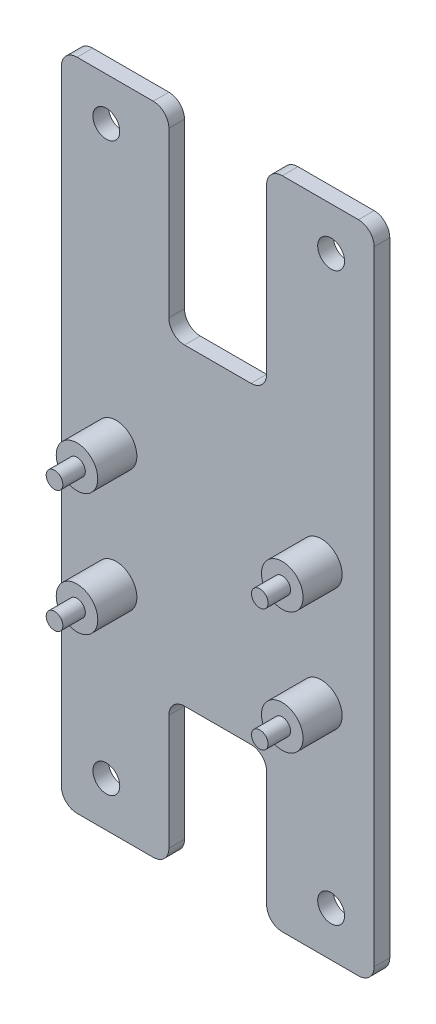
from build123d import *

# Parameters (mm, degrees)
SZKIC2_W                        = 32
SZKIC2_H                        = 67
SZKIC2_R                        = 1.375001118
SZKIC2_R_2                      = 1.375002453
SZKIC2_R_3                      = 1.374998979
SZKIC2_R_4                      = 1.375001969
DODANIE_WYCI_GNI_CIE1_DEPTH     = 1.6
SZKIC3_R                        = 2.125002003
SZKIC3_R_2                      = 2.125000412
SZKIC3_R_3                      = 2.124999361
SZKIC3_R_4                      = 2.125
DODANIE_WYCI_GNI_CIE2_DEPTH     = 4
SZKIC4_R                        = 0.85
DODANIE_WYCI_GNI_CIE3_DEPTH     = 2.3
WYTNIJ_WYCI_GNI_CIE1_DEPTH      = 75.51637404
WYTNIJ_WYCI_GNI_CIE1_DEPTH_BACK = 75.51637404
SZKIC5_W                        = 10
SZKIC5_H                        = 20
SZKIC5_H_2                      = 15
ZAOKR_GLENIE1_R                 = 1.6


with BuildPart() as part:
    # Szkic2 → Dodanie-wyciągnięcie1 (new body)
    with BuildSketch(Plane.XY):
        with Locations((16, 33.5)):
            Rectangle(SZKIC2_W, SZKIC2_H)
        with Locations((4.60000054, 4.59999621)):
            Circle(SZKIC2_R, mode=Mode.SUBTRACT)
        with Locations((27.599994617, 4.599998848)):
            Circle(SZKIC2_R_2, mode=Mode.SUBTRACT)
        with Locations((27.599997676, 62.599998714)):
            Circle(SZKIC2_R_3, mode=Mode.SUBTRACT)
        with Locations((4.599996565, 62.599994963)):
            Circle(SZKIC2_R_4, mode=Mode.SUBTRACT)
    extrude(amount=DODANIE_WYCI_GNI_CIE1_DEPTH)

    # Szkic3 → Dodanie-wyciągnięcie2 (add)
    with BuildSketch(Plane.XY.offset(1.6)):
        with Locations(Location((5.599998705, 34.699994945, 0), (0, 0, 180))):
            Circle(SZKIC3_R)
        with Locations(Location((26.599994052, 34.699996536, 0), (0, 0, 180))):
            Circle(SZKIC3_R_2)
        with Locations(Location((5.599997835, 22.199997588, 0), (0, 0, 180))):
            Circle(SZKIC3_R_3)
        with Locations(Location((26.599996674, 22.199996948, 0), (0, 0, 180))):
            Circle(SZKIC3_R_4)
    extrude(amount=DODANIE_WYCI_GNI_CIE2_DEPTH)

    # Szkic4 → Dodanie-wyciągnięcie3 (add)
    with BuildSketch(Plane.XY.offset(5.6)):
        with Locations((5.599998705, 34.699994945)):
            Circle(SZKIC4_R)
        with Locations((26.599994052, 34.699996536)):
            Circle(SZKIC4_R)
        with Locations((5.599997835, 22.199997588)):
            Circle(SZKIC4_R)
        with Locations((26.599996674, 22.199996948)):
            Circle(SZKIC4_R)
    extrude(amount=DODANIE_WYCI_GNI_CIE3_DEPTH)

    # Szkic5 → Wytnij-wyciągnięcie1 (cut, two sides: drawn at the far end of the back side and taken through both)
    with BuildSketch(Plane.XY.offset(1.6).offset(-WYTNIJ_WYCI_GNI_CIE1_DEPTH_BACK)):
        with Locations((16, 57)):
            Rectangle(SZKIC5_W, SZKIC5_H)
        with Locations((16, 7.5)):
            Rectangle(SZKIC5_W, SZKIC5_H_2)
    extrude(amount=WYTNIJ_WYCI_GNI_CIE1_DEPTH + WYTNIJ_WYCI_GNI_CIE1_DEPTH_BACK, mode=Mode.SUBTRACT)

    # Zaokrąglenie1
    zaokr_glenie1_edges = [part.edges().sort_by_distance(p)[0] for p in [
        (0, 67, 0.8),
        (21, 0, 0.8),
        (11, 15, 0.8),
        (32, 67, 0.8),
        (11, 0, 0.8),
        (21, 15, 0.8),
        (32, 0, 0.8),
        (0, 0, 0.8),
        (11, 67, 0.8),
        (21, 47, 0.8),
        (21, 67, 0.8),
        (11, 47, 0.8),
    ]]
    fillet(zaokr_glenie1_edges, radius=ZAOKR_GLENIE1_R)


solid = part.part
